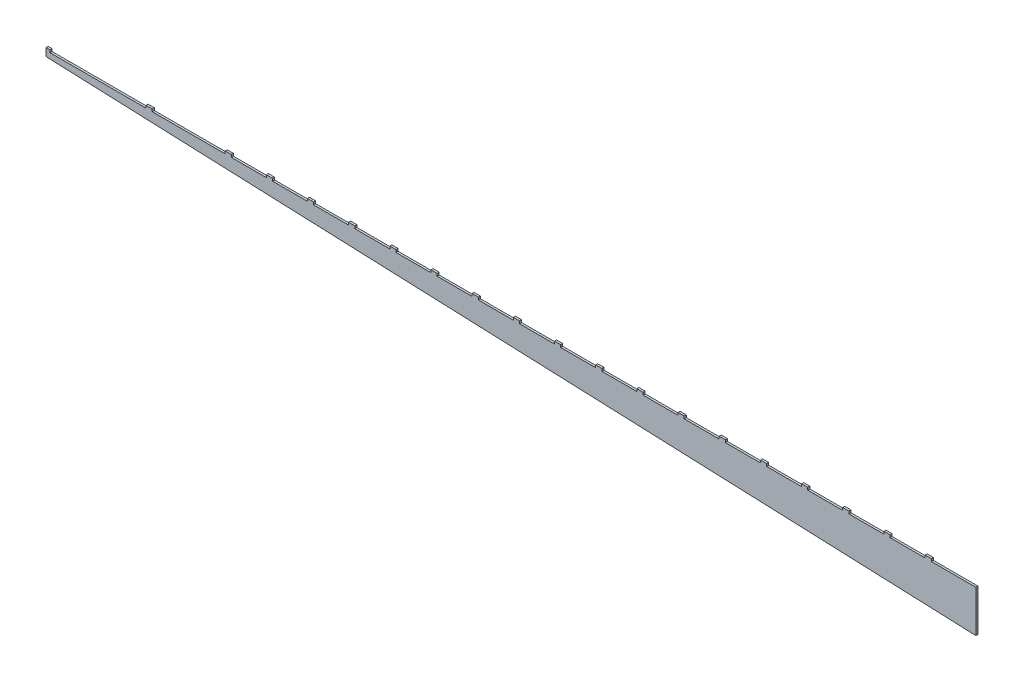
from build123d import *

# Parameters (mm, degrees)
EXTRUDE1_DEPTH         = 0.127
SKETCH4_W              = 0.508
SKETCH4_H              = 0.3048
SKETCH4_W_2            = 0.762
SKETCH4_H_2            = 0.508
EB_02_TAB_1_DEPTH      = 0.127
SKETCH2_W              = 0.762
SKETCH2_H              = 0.5588
EB_02_TAB_2_DEPTH      = 0.127
LP_01_TAB_2_X_18_COUNT = 18
LP_01_TAB_2_X_18_PITCH = 5.08


with BuildPart() as part:
    # Sketch1 → Extrude1 (new, symmetric)
    with BuildSketch(Plane.XY):
        Polygon((16.891, 0), (131.6228, 0), (131.6228, -5.171473897), (16.891, -0.663649197), align=None)
    extrude(amount=EXTRUDE1_DEPTH, both=True)

    # Sketch4 → EB-02 Tab 1 (add, symmetric)
    with BuildSketch(Plane.XY):
        with Locations((17.145, 0.1524)):
            Rectangle(SKETCH4_W, SKETCH4_H)
        with Locations((29.6164, 0.0508)):
            Rectangle(SKETCH4_W_2, SKETCH4_H_2)
    extrude(amount=EB_02_TAB_1_DEPTH, both=True)

    # Sketch2 → EB-02 Tab 2 (add, symmetric)
    with BuildSketch(Plane.XY):
        with Locations((39.37, 0.0254)):
            Rectangle(SKETCH2_W, SKETCH2_H)
    eb_02_tab_2 = extrude(amount=EB_02_TAB_2_DEPTH, both=True)

    # LP-01 Tab 2 x 18: EB-02 Tab 2 ×18
    with Locations(*[(i * LP_01_TAB_2_X_18_PITCH, 0, 0) for i in range(1, LP_01_TAB_2_X_18_COUNT)]):
        add(eb_02_tab_2)


solid = part.part
